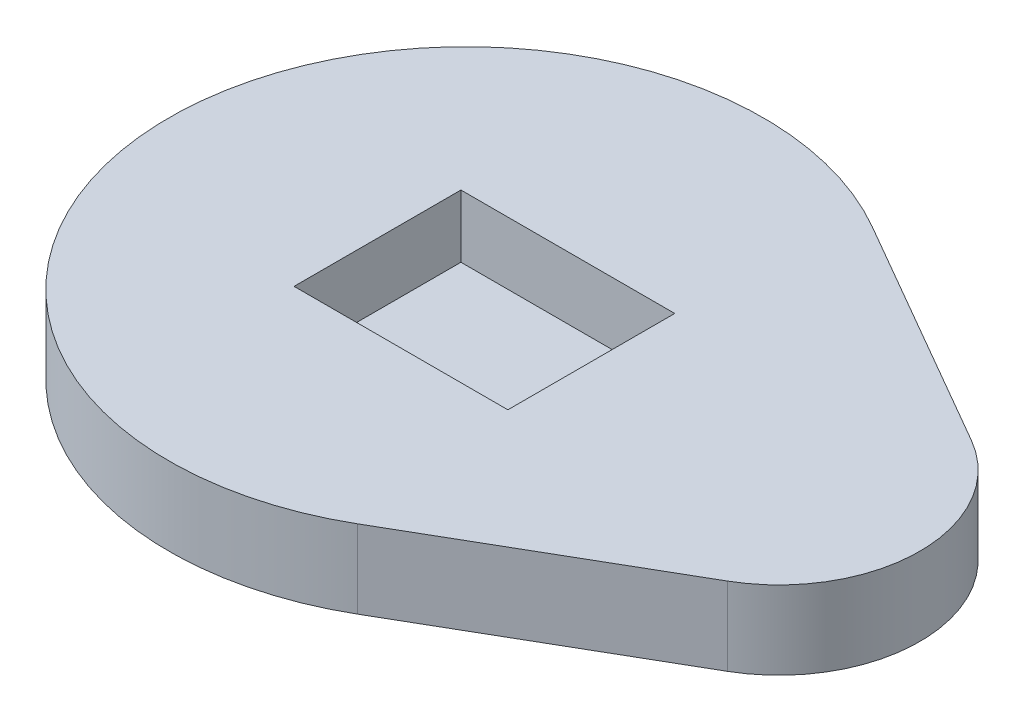
from build123d import *

# Parameters (mm, degrees)
BOSS_EXTRUDE1_DEPTH = 15
SKETCH2_W           = 41
SKETCH2_H           = 32
CUT_EXTRUDE1_DEPTH  = 12


with BuildPart() as part:
    # Sketch1 → Boss-Extrude1 (new body)
    with BuildSketch(Plane(origin=(0, 0, 0), x_dir=(1, 0, 0), z_dir=(0, 1, 0))):
        with BuildLine():
            Line((13.5, -49.363448016), (58.499999998, -23.382685903))
            ThreePointArc((58.499999998, -23.382685903), (71.999999999, 0), (58.499999998, 23.382685903))
            Line((58.499999998, 23.382685903), (13.5, 49.363448016))
            ThreePointArc((13.5, 49.363448016), (-72, 0), (13.5, -49.363448016))
        make_face()
    extrude(amount=BOSS_EXTRUDE1_DEPTH)

    # Sketch2 → Cut-Extrude1 (cut)
    with BuildSketch(Plane(origin=(0, 15, 0), x_dir=(1, 0, 0), z_dir=(0, 1, 0))):
        with Locations((-11.5, 0)):
            Rectangle(SKETCH2_W, SKETCH2_H)
    extrude(amount=-CUT_EXTRUDE1_DEPTH, mode=Mode.SUBTRACT)


solid = part.part
